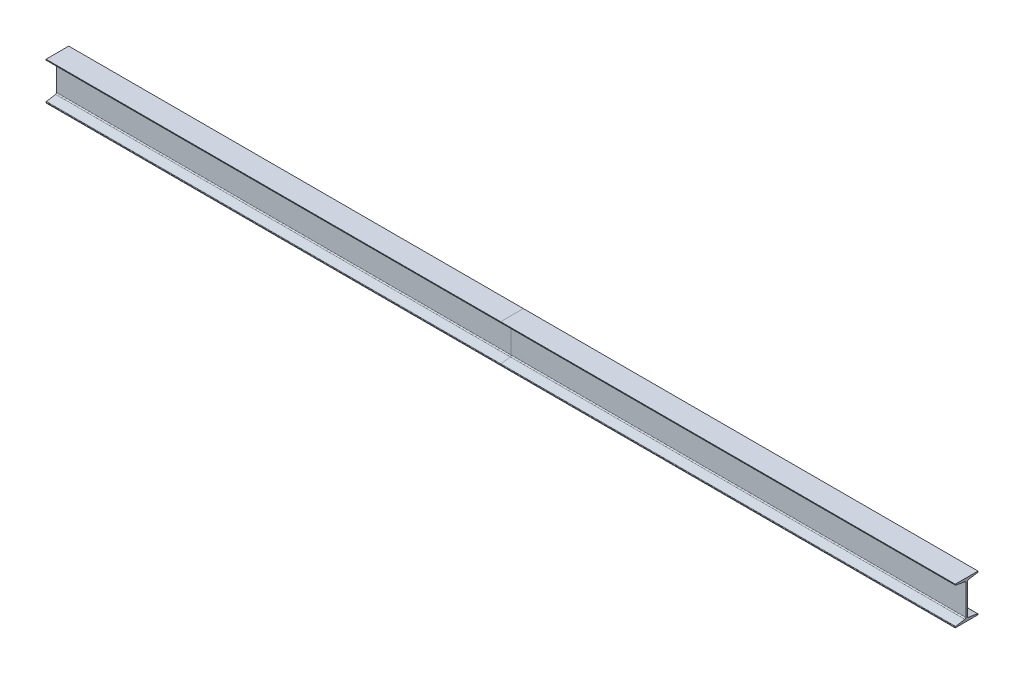
from build123d import *

# Parameters (mm, degrees)
STRUCTURAL_MEMBER1_DEPTH   = 3048
STRUCTURAL_MEMBER1_2_DEPTH = 3048


with BuildPart() as part:
    # Sketch11 → Structural Member1 (new body)
    with BuildSketch(Plane(origin=(0, 0, 0), x_dir=(0, 0, 1), z_dir=(1, 0, 0))):
        with BuildLine():
            Line((-76.2, -127), (-76.2, -122.87924041))
            ThreePointArc((-76.2, -122.87924041), (-75.417504606, -120.744925405), (-73.440883986, -119.622174095))
            Line((-73.440883986, -119.622174095), (-11.913430494, -109.366850442))
            ThreePointArc((-11.913430494, -109.366850442), (-7.199950554, -106.689520396), (-5.334, -101.6))
            Line((-5.334, -101.6), (-5.334, 101.6))
            ThreePointArc((-5.334, 101.6), (-7.199950554, 106.689520396), (-11.913430494, 109.366850442))
            Line((-11.913430494, 109.366850442), (-73.440883986, 119.622174095))
            ThreePointArc((-73.440883986, 119.622174095), (-75.417504606, 120.744925405), (-76.2, 122.87924041))
            Line((-76.2, 122.87924041), (-76.2, 127))
            Line((-76.2, 127), (76.2, 127))
            Line((76.2, 127), (76.2, 122.87924041))
            ThreePointArc((76.2, 122.87924041), (75.417504606, 120.744925405), (73.440883986, 119.622174095))
            Line((73.440883986, 119.622174095), (11.913430494, 109.366850442))
            ThreePointArc((11.913430494, 109.366850442), (7.199950554, 106.689520396), (5.334, 101.6))
            Line((5.334, 101.6), (5.334, -101.6))
            ThreePointArc((5.334, -101.6), (7.199950554, -106.689520396), (11.913430494, -109.366850442))
            Line((11.913430494, -109.366850442), (73.440883986, -119.622174095))
            ThreePointArc((73.440883986, -119.622174095), (75.417504606, -120.744925405), (76.2, -122.87924041))
            Line((76.2, -122.87924041), (76.2, -127))
            Line((76.2, -127), (-76.2, -127))
        make_face()
    extrude(amount=STRUCTURAL_MEMBER1_DEPTH)


with BuildPart() as body_2:
    # Sketch11 on segment 2 (carried to segment 2) → Structural Member1 2 (new body)
    with BuildSketch(Plane(origin=(3048, 0, 0), x_dir=(0, 0, 1), z_dir=(1, 0, 0))):
        with BuildLine():
            Line((-76.2, -127), (-76.2, -122.87924041))
            ThreePointArc((-76.2, -122.87924041), (-75.417504606, -120.744925405), (-73.440883986, -119.622174095))
            Line((-73.440883986, -119.622174095), (-11.913430494, -109.366850442))
            ThreePointArc((-11.913430494, -109.366850442), (-7.199950554, -106.689520396), (-5.334, -101.6))
            Line((-5.334, -101.6), (-5.334, 101.6))
            ThreePointArc((-5.334, 101.6), (-7.199950554, 106.689520396), (-11.913430494, 109.366850442))
            Line((-11.913430494, 109.366850442), (-73.440883986, 119.622174095))
            ThreePointArc((-73.440883986, 119.622174095), (-75.417504606, 120.744925405), (-76.2, 122.87924041))
            Line((-76.2, 122.87924041), (-76.2, 127))
            Line((-76.2, 127), (76.2, 127))
            Line((76.2, 127), (76.2, 122.87924041))
            ThreePointArc((76.2, 122.87924041), (75.417504606, 120.744925405), (73.440883986, 119.622174095))
            Line((73.440883986, 119.622174095), (11.913430494, 109.366850442))
            ThreePointArc((11.913430494, 109.366850442), (7.199950554, 106.689520396), (5.334, 101.6))
            Line((5.334, 101.6), (5.334, -101.6))
            ThreePointArc((5.334, -101.6), (7.199950554, -106.689520396), (11.913430494, -109.366850442))
            Line((11.913430494, -109.366850442), (73.440883986, -119.622174095))
            ThreePointArc((73.440883986, -119.622174095), (75.417504606, -120.744925405), (76.2, -122.87924041))
            Line((76.2, -122.87924041), (76.2, -127))
            Line((76.2, -127), (-76.2, -127))
        make_face()
    extrude(amount=STRUCTURAL_MEMBER1_2_DEPTH)


solid = Compound([part.part, body_2.part])
